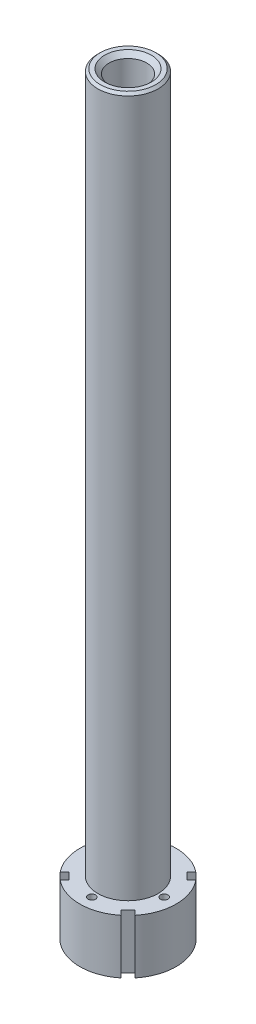
from build123d import *

# Parameters (mm, degrees)
SKETCH_1_R               = 10
EXTRUDE_1_DEPTH          = 250
SKETCH_6_R               = 16
EXTRUDE_2_DEPTH          = 18
CUT_EXTRUDE_START        = 30
SKETCH_2_R               = 6
CUT_EXTRUDE_1_DEPTH      = 260
M14X1_5_1_D              = 12.5
M14X1_5_1_DEPTH          = 35
M14X1_5_1_TIP            = 3.755378869
CHAMFER_1_SIZE           = 1.5
SKETCH_8_R               = 8
CUT_EXTRUDE_2_DEPTH      = 15.5
HOLE_WIZARD_M3_1_D       = 2.5
HOLE_WIZARD_M3_1_DEPTH   = 25
HOLE_WIZARD_M3_1_TIP     = 0.751075774
CUT_EXTRUDE_1_2_DEPTH    = 252.021911394
PATTERN_CIRCULAR_1_COUNT = 4
CHAMFER_2_SIZE           = 0.8


with BuildPart() as part:
    # 草图1 → 凸台-拉伸1 (new body)
    with BuildSketch(Plane(origin=(0, 0, 0), x_dir=(1, 0, 0), z_dir=(0, 1, 0))):
        with Locations(Location((0, 0, 0), (0, 0, 270))):
            Circle(SKETCH_1_R)
    extrude(amount=EXTRUDE_1_DEPTH)

    # 草图6 → 凸台-拉伸2 (add)
    with BuildSketch(Plane.XZ):
        with Locations(Location((0, 0, 0), (0, 0, 270))):
            Circle(SKETCH_6_R)
    extrude(amount=-EXTRUDE_2_DEPTH)

    # 草图2 → Cut-Extrude 1 (cut)
    with BuildSketch(Plane.XZ.offset(-250).offset(CUT_EXTRUDE_START)):
        with Locations(Location((0, 0, 0), (0, 0, 90))):
            Circle(SKETCH_2_R)
    extrude(amount=CUT_EXTRUDE_1_DEPTH, mode=Mode.SUBTRACT)

    # M14x1.5 螺纹孔1
    with Locations(Plane(origin=(0, 250, 0), x_dir=(1, 0, 0), z_dir=(0, 1, 0))):
        with Locations((0, 0)):
            Hole(M14X1_5_1_D / 2, depth=M14X1_5_1_DEPTH)
            with Locations((0, 0, -(M14X1_5_1_DEPTH + M14X1_5_1_TIP / 2))):  # 118° drill point
                Cone(0, M14X1_5_1_D / 2, M14X1_5_1_TIP, mode=Mode.SUBTRACT)

    # 倒角1
    chamfer_1_edges = [part.edges().sort_by_distance(p)[0] for p in [
        (6.25, 250, 0),
    ]]
    chamfer(chamfer_1_edges, length=CHAMFER_1_SIZE)

    # 草图8 → 切除-拉伸2 (cut)
    with BuildSketch(Plane.XZ):
        with Locations(Location((0, 0, 0), (0, 0, 270))):
            Circle(SKETCH_8_R)
    extrude(amount=-CUT_EXTRUDE_2_DEPTH, mode=Mode.SUBTRACT)

    # M3 螺纹孔1
    with Locations(Plane(origin=(0, 0, 0), x_dir=(-1, 0, 0), z_dir=(0, -1, 0))):
        with Locations((0, 12), (12, 0), (0, -12), (-12, 0)):
            Hole(HOLE_WIZARD_M3_1_D / 2, depth=HOLE_WIZARD_M3_1_DEPTH)
            with Locations((0, 0, -(HOLE_WIZARD_M3_1_DEPTH + HOLE_WIZARD_M3_1_TIP / 2))):  # 118° drill point
                Cone(0, HOLE_WIZARD_M3_1_D / 2, HOLE_WIZARD_M3_1_TIP, mode=Mode.SUBTRACT)

    # 草图13 → Cut-Extrude 1 2 (cut, symmetric)
    with BuildSketch(Plane.XZ):
        Polygon((-8.62670273, 10.88944443), (-10.182337649, 12.445079349), (-12.445079349, 10.182337649), (-10.88944443, 8.62670273), align=None)
    cut_extrude_1_2 = extrude(amount=CUT_EXTRUDE_1_2_DEPTH, both=True, mode=Mode.SUBTRACT)

    # 阵列(圆周)1: Cut-Extrude 1 2 ×4 about axis
    pattern_circular_1_axis = Axis((0, 0, 0), (0, 1, 0))
    for i in range(1, PATTERN_CIRCULAR_1_COUNT):
        add(cut_extrude_1_2.rotate(pattern_circular_1_axis, i * 360 / PATTERN_CIRCULAR_1_COUNT), mode=Mode.SUBTRACT)

    # 倒角2
    chamfer_2_edges = [part.edges().sort_by_distance(p)[0] for p in [
        (0, 250, -10),
    ]]
    chamfer(chamfer_2_edges, length=CHAMFER_2_SIZE)


solid = part.part
